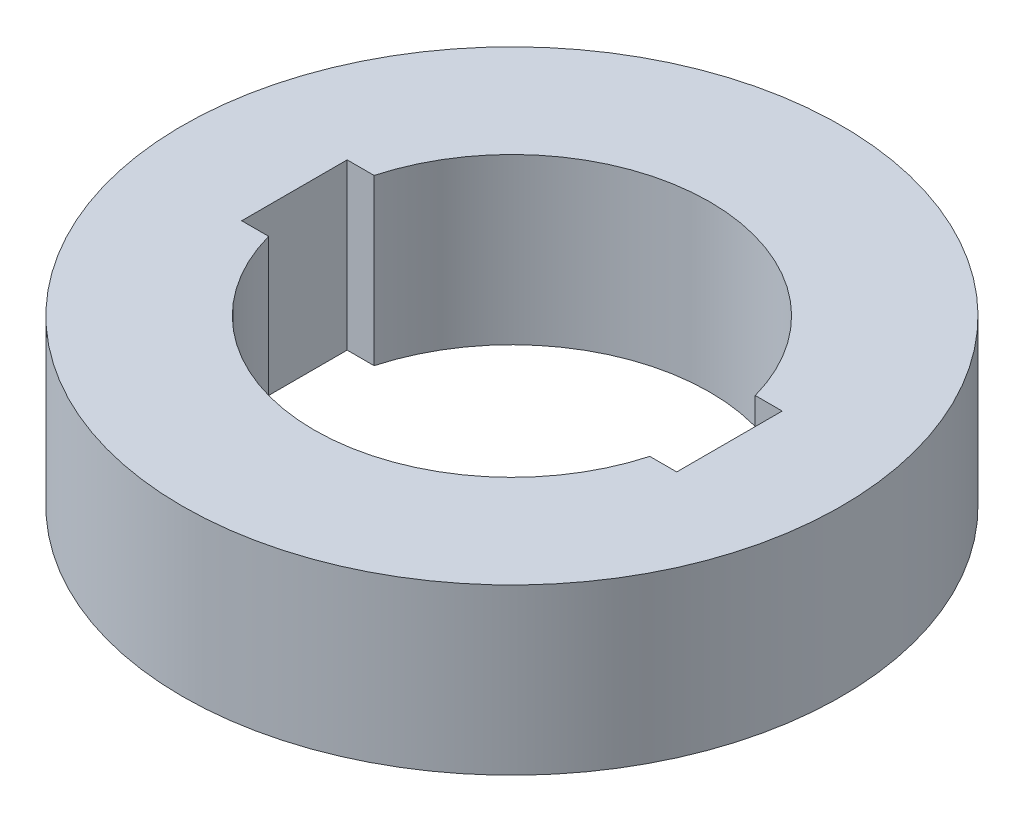
from build123d import *

# Parameters (mm, degrees)
SKETCH2_R           = 50
BOSS_EXTRUDE1_DEPTH = 25
CUT_EXTRUDE1_DEPTH  = 25


with BuildPart() as part:
    # Sketch2 → Boss-Extrude1 (new body)
    with BuildSketch(Plane(origin=(0, 0, 0), x_dir=(1, 0, 0), z_dir=(0, 1, 0))):
        with Locations(Location((0, 0, 0), (0, 0, 270))):
            Circle(SKETCH2_R)
    extrude(amount=BOSS_EXTRUDE1_DEPTH)

    # Sketch3 → Cut-Extrude1 (cut)
    with BuildSketch(Plane(origin=(0, 25, 0), x_dir=(1, 0, 0), z_dir=(0, 1, 0))):
        with BuildLine():
            Line((33, 8), (33, -8))
            Line((33, -8), (28.91366459, -8))
            ThreePointArc((28.91366459, -8), (0, -30), (-28.91366459, -8))
            Line((-28.91366459, -8), (-33, -8))
            Line((-33, -8), (-33, 8))
            Line((-33, 8), (-28.91366459, 8))
            ThreePointArc((-28.91366459, 8), (0, 30), (28.91366459, 8))
            Line((28.91366459, 8), (33, 8))
        make_face()
    extrude(amount=-CUT_EXTRUDE1_DEPTH, mode=Mode.SUBTRACT)


solid = part.part
